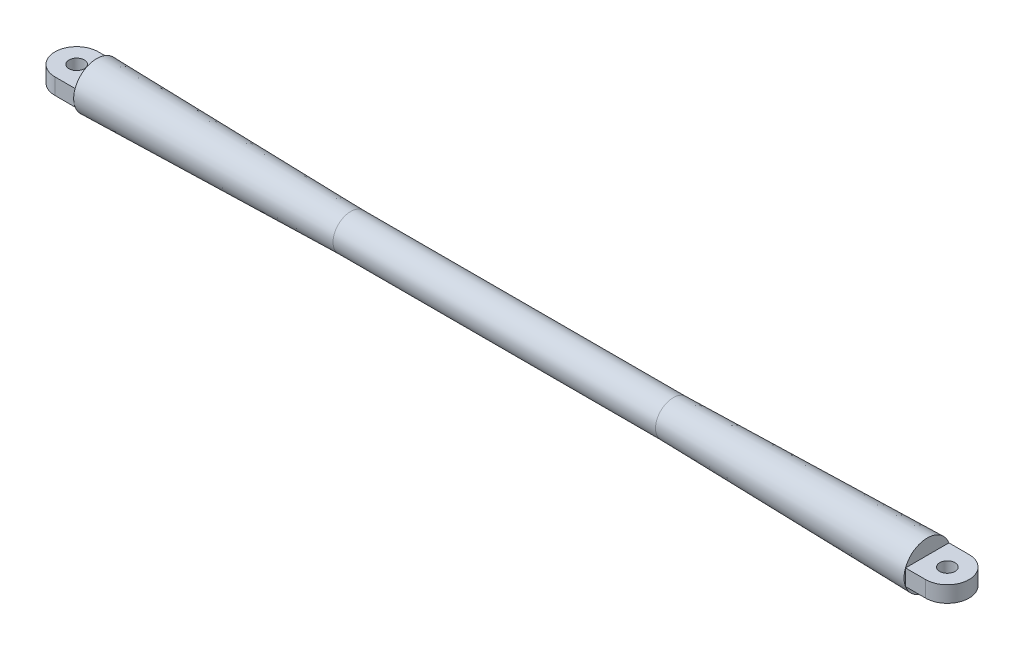
from build123d import *

# Parameters (mm, degrees)
SKETCH2_W          = 81.219896545
SKETCH2_H          = 40.203731022
CUT_EXTRUDE1_DEPTH = 35
CUT_EXTRUDE2_DEPTH = 35
SKETCH4_R          = 9.5
CUT_EXTRUDE3_DEPTH = 569.968860373


with BuildPart() as part:
    # Sketch1 → Revolve1 (revolve)
    with BuildSketch(Plane.XY, mode=Mode.PRIVATE) as revolve1_sk:
        Polygon((0, 0), (575, 0), (575, 30), (200, 22), (0, 22), align=None)
    revolve1 = revolve(revolve1_sk.sketch.rotate(Axis((0, 0, 0), (1, 0, 0)), 90), axis=Axis((0, 0, 0), (1, 0, 0)))

    # Sketch2 → Cut-Extrude1 (cut, symmetric)
    with BuildSketch(Plane.XY):
        with Locations((555.609948272, 30.101865511)):
            Rectangle(SKETCH2_W, SKETCH2_H)
        with Locations((555.609948272, -30.101865511)):
            Rectangle(SKETCH2_W, SKETCH2_H)
    cut_extrude1 = extrude(amount=CUT_EXTRUDE1_DEPTH, both=True, mode=Mode.SUBTRACT)

    # Sketch3 → Cut-Extrude2 (cut, symmetric)
    with BuildSketch(Plane(origin=(0, 10, 0), x_dir=(1, 0, 0), z_dir=(0, 1, 0))):
        with BuildLine():
            Line((515, 26.922823032), (540, 26.922823032))
            ThreePointArc((540, 26.922823032), (566.922823032, 0), (540, -26.922823032))
            Line((540, -26.922823032), (515, -26.922823032))
            Line((515, -26.922823032), (515, -33.426109463))
            Line((515, -33.426109463), (579.528771991, -33.426109463))
            Line((579.528771991, -33.426109463), (579.528771991, 35.099670457))
            Line((579.528771991, 35.099670457), (515, 35.099670457))
            Line((515, 35.099670457), (515, 26.922823032))
        make_face()
    cut_extrude2 = extrude(amount=CUT_EXTRUDE2_DEPTH, both=True, mode=Mode.SUBTRACT)

    # Sketch4 → Cut-Extrude3 (cut, through all)
    with BuildSketch(Plane(origin=(0, 10, 0), x_dir=(1, 0, 0), z_dir=(0, 1, 0))):
        with Locations(Location((540, 0, 0), (0, 0, 180))):
            Circle(SKETCH4_R)
    cut_extrude3 = extrude(amount=-CUT_EXTRUDE3_DEPTH, mode=Mode.SUBTRACT)

    # Mirror1: Revolve1, Cut-Extrude1, Cut-Extrude2, Cut-Extrude3 across plane
    add(revolve1.mirror(Plane(origin=(0, 0, 0), x_dir=(0, 0, 1), z_dir=(1, 0, 0))))
    add(cut_extrude1.mirror(Plane(origin=(0, 0, 0), x_dir=(0, 0, 1), z_dir=(1, 0, 0))), mode=Mode.SUBTRACT)
    add(cut_extrude2.mirror(Plane(origin=(0, 0, 0), x_dir=(0, 0, 1), z_dir=(1, 0, 0))), mode=Mode.SUBTRACT)
    add(cut_extrude3.mirror(Plane(origin=(0, 0, 0), x_dir=(0, 0, 1), z_dir=(1, 0, 0))), mode=Mode.SUBTRACT)


solid = part.part
